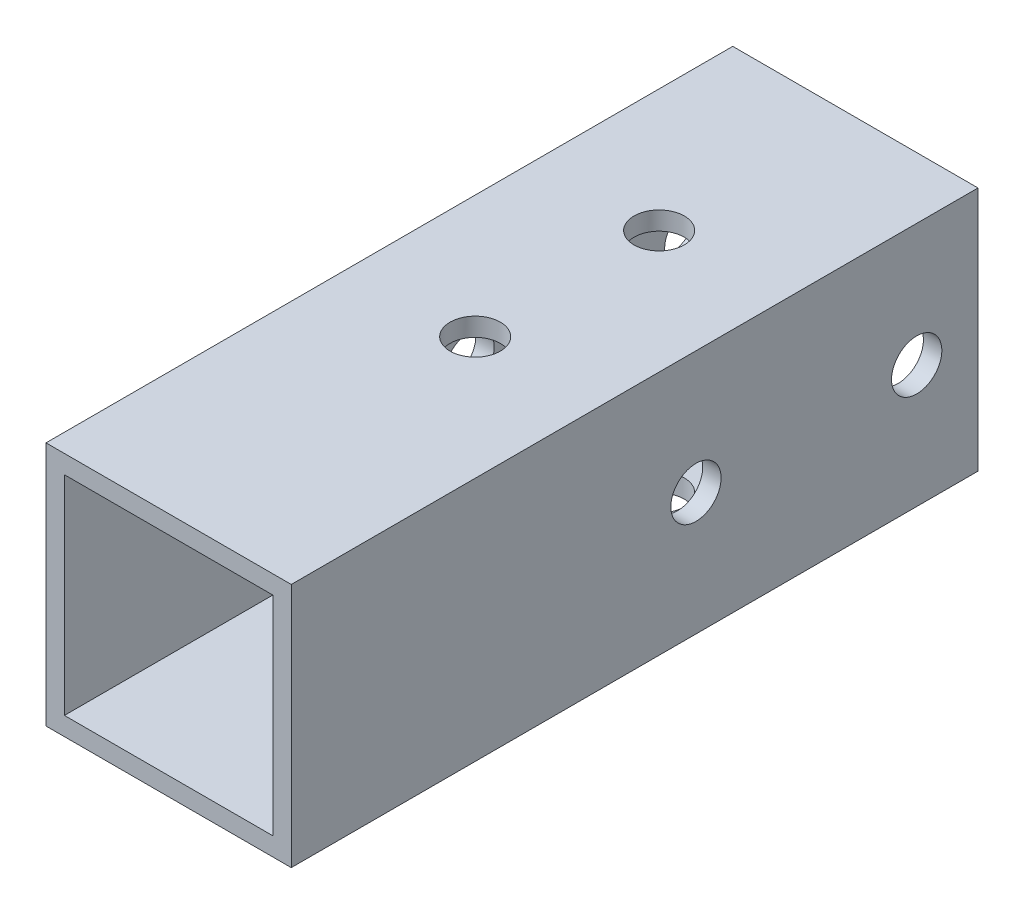
from build123d import *

# Parameters (mm, degrees)
SKETCH_1_W          = 20
SKETCH_1_H          = 20
SKETCH_1_W_2        = 17
SKETCH_1_H_2        = 17
EXTRUDE_1_DEPTH     = 56
SKETCH_3_R          = 2.05
CUT_EXTRUDE_1_DEPTH = 23
SKETCH_4_R          = 2.05
CUT_EXTRUDE_2_DEPTH = 23


with BuildPart() as part:
    # 草图1 → 凸台-拉伸1 (new body)
    with BuildSketch(Plane.XY):
        Rectangle(SKETCH_1_W, SKETCH_1_H)
        Rectangle(SKETCH_1_W_2, SKETCH_1_H_2, mode=Mode.SUBTRACT)
    extrude(amount=EXTRUDE_1_DEPTH)

    # 草图3 → 切除-拉伸1 (cut)
    with BuildSketch(Plane.ZY.offset(10)):
        with Locations(Location((5, 0, 0), (0, 0, 270))):
            Circle(SKETCH_3_R)
        with Locations(Location((23, 0, 0), (0, 0, 270))):
            Circle(SKETCH_3_R)
    extrude(amount=-CUT_EXTRUDE_1_DEPTH, mode=Mode.SUBTRACT)

    # 草图4 → 切除-拉伸2 (cut)
    with BuildSketch(Plane(origin=(0, 10, 0), x_dir=(1, 0, 0), z_dir=(0, 1, 0))):
        with Locations(Location((0, -16, 0), (0, 0, 270))):
            Circle(SKETCH_4_R)
        with Locations(Location((0, -31, 0), (0, 0, 270))):
            Circle(SKETCH_4_R)
    extrude(amount=-CUT_EXTRUDE_2_DEPTH, mode=Mode.SUBTRACT)


solid = part.part
